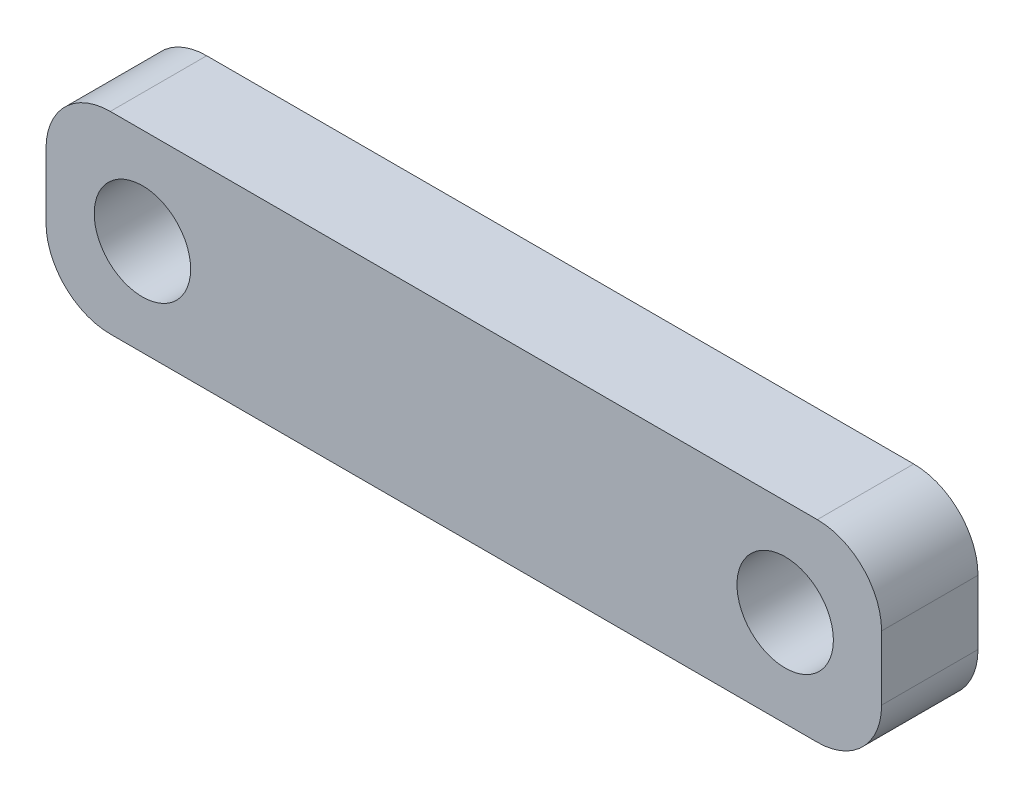
from build123d import *

# Parameters (mm, degrees)
SKETCH1_W           = 26
SKETCH1_H           = 6
SKETCH1_R           = 1.5
BOSS_EXTRUDE1_DEPTH = 3
FILLET1_R           = 2


with BuildPart() as part:
    # Sketch1 → Boss-Extrude1 (new body)
    with BuildSketch(Plane.XY):
        with Locations((13, 3)):
            Rectangle(SKETCH1_W, SKETCH1_H)
        with Locations((3, 3)):
            Circle(SKETCH1_R, mode=Mode.SUBTRACT)
        with Locations((23, 3)):
            Circle(SKETCH1_R, mode=Mode.SUBTRACT)
    extrude(amount=BOSS_EXTRUDE1_DEPTH)

    # Fillet1
    fillet1_edges = [part.edges().sort_by_distance(p)[0] for p in [
        (0, 6, 1.5),
        (26, 6, 1.5),
        (26, 0, 1.5),
        (0, 0, 1.5),
    ]]
    fillet(fillet1_edges, radius=FILLET1_R)


solid = part.part
